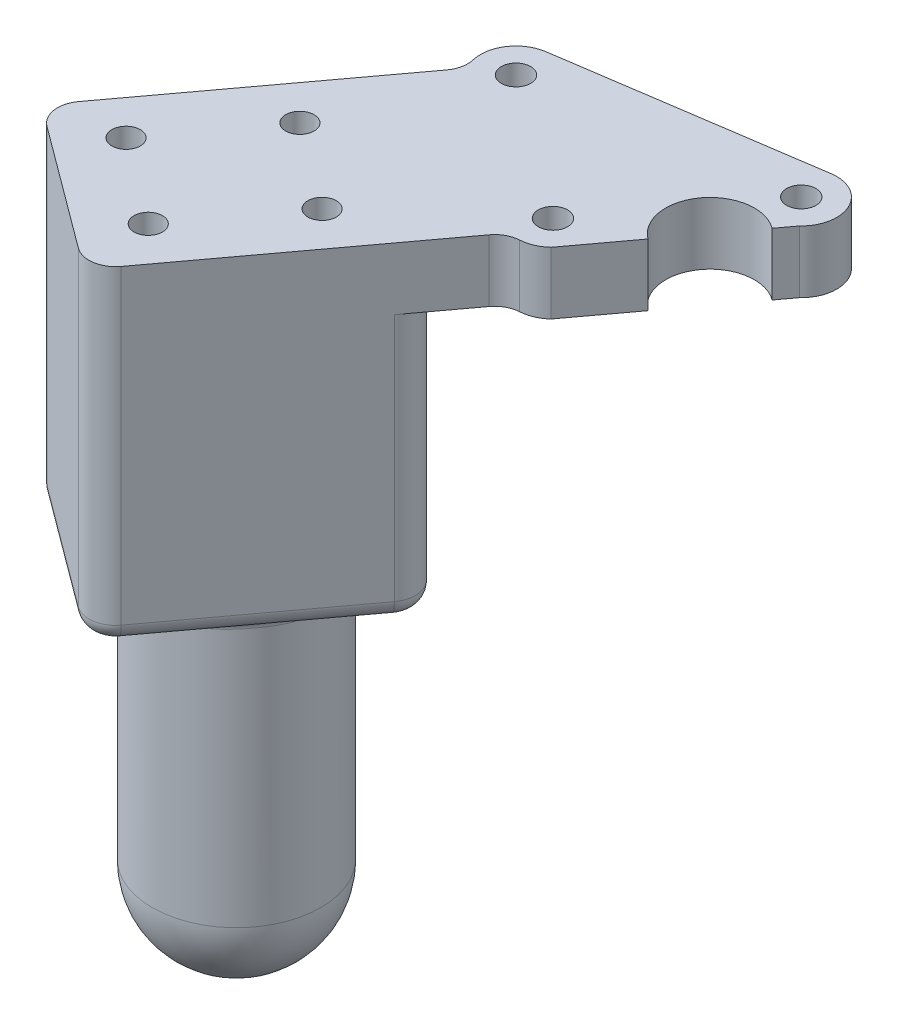
from build123d import *

# Parameters (mm, degrees)
SKETCH1_R           = 1.650000007
BOSS_EXTRUDE1_DEPTH = 3.5
SKETCH8_R           = 5
CUT_EXTRUDE3_DEPTH  = 10
SKETCH9_R           = 1.6
CUT_EXTRUDE4_DEPTH  = 10
BOSS_EXTRUDE5_DEPTH = 30
FILLET4_R           = 2
SKETCH13_R          = 9.5
BOSS_EXTRUDE6_DEPTH = 30
FILLET5_R           = 1
REVOLVE2_ANGLE      = 180


with BuildPart() as part:
    # Sketch1 → Boss-Extrude1 (new, symmetric)
    with BuildSketch(Plane(origin=(0, 0, 0), x_dir=(1, 0, 0), z_dir=(0, 1, 0))):
        with BuildLine():
            Line((-3.163944782, -93.076388076), (-20.805834618, -116.891940565))
            ThreePointArc((-20.805834618, -116.891940565), (-21.362478255, -119.119545961), (-20.180929864, -121.088307332))
            Line((-20.180929864, -121.088307332), (-6.520660553, -131.207449705))
            ThreePointArc((-6.520660553, -131.207449705), (-4.293055157, -131.764093342), (-2.324293786, -130.582544951))
            Line((-2.324293786, -130.582544951), (15.317595998, -106.766992534))
            ThreePointArc((15.317595998, -106.766992534), (16.298016652, -105.915587831), (17.546382486, -105.558240139))
            ThreePointArc((17.546382486, -105.558240139), (18.880171652, -105.241928098), (20.028844772, -104.493865997))
            Line((20.028844772, -104.493865997), (31.933718152, -88.422960925))
            ThreePointArc((31.933718152, -88.422960925), (32.812947077, -83.759740105), (28.619624318, -81.538318002))
            Line((28.619624318, -81.538318002), (0.643845867, -85.704349694))
            ThreePointArc((0.643845867, -85.704349694), (-2.081865152, -87.422063847), (-2.657041002, -90.592113564))
            ThreePointArc((-2.657041002, -90.592113564), (-2.635147269, -91.890433717), (-3.163944782, -93.076388076))
        make_face()
        with Locations(Location((1.233011719, -89.660722224, 0), (0, 0, 90))):
            Circle(SKETCH1_R, mode=Mode.SUBTRACT)
        with Locations(Location((29.20879017, -85.494690532, 0), (0, 0, 90))):
            Circle(SKETCH1_R, mode=Mode.SUBTRACT)
        with Locations(Location((17.30391679, -101.565595604, 0), (0, 0, 90))):
            Circle(SKETCH1_R, mode=Mode.SUBTRACT)
    extrude(amount=BOSS_EXTRUDE1_DEPTH, both=True)

    # Sketch8 → Cut-Extrude3 (cut)
    with BuildSketch(Plane(origin=(0, 3.5, 0), x_dir=(1, 0, 0), z_dir=(0, 1, 0))):
        with Locations((27.647963735, -94.208486751)):
            Circle(SKETCH8_R)
    extrude(amount=-CUT_EXTRUDE3_DEPTH, mode=Mode.SUBTRACT)

    # Sketch9 → Cut-Extrude4 (cut)
    with BuildSketch(Plane(origin=(0, 3.5, 0), x_dir=(1, 0, 0), z_dir=(0, 1, 0))):
        with Locations(Location((-6.267193351, -106.505511433, 0), (0, 0, 270))):
            Circle(SKETCH9_R)
        with Locations(Location((3.375349692, -113.648435461, 0), (0, 0, 270))):
            Circle(SKETCH9_R)
        with Locations(Location((-4.958061673, -124.898069011, 0), (0, 0, 270))):
            Circle(SKETCH9_R)
        with Locations(Location((-14.600604716, -117.755144983, 0), (0, 0, 270))):
            Circle(SKETCH9_R)
    extrude(amount=-CUT_EXTRUDE4_DEPTH, mode=Mode.SUBTRACT)

    # Sketch11 → Boss-Extrude5 (add)
    with BuildSketch(Plane.XZ.offset(3.5)):
        with BuildLine():
            Line((-3.514107133, 98.589040232), (10.146162178, 108.708182605))
            ThreePointArc((10.146162178, 108.708182605), (11.327710569, 110.676943976), (10.771066932, 112.904549372))
            Line((10.771066932, 112.904549372), (-2.324293786, 130.582544951))
            ThreePointArc((-2.324293786, 130.582544951), (-4.293055157, 131.764093342), (-6.520660553, 131.207449705))
            Line((-6.520660553, 131.207449705), (-20.180929864, 121.088307332))
            ThreePointArc((-20.180929864, 121.088307332), (-21.362478255, 119.119545961), (-20.805834618, 116.891940565))
            Line((-20.805834618, 116.891940565), (-7.710473901, 99.213944986))
            ThreePointArc((-7.710473901, 99.213944986), (-5.741712529, 98.032396595), (-3.514107133, 98.589040232))
        make_face()
    extrude(amount=BOSS_EXTRUDE5_DEPTH)

    # Fillet4
    fillet4_edges = [part.edges().sort_by_distance(p)[0] for p in [
        (-21.362478255, -33.5, 119.119545961),
        (-14.258154259, -33.5, 108.052942775),
        (-5.741712529, -33.5, 98.032396595),
        (3.316027522, -33.5, 103.648611418),
        (11.327710569, -33.5, 110.676943976),
        (4.223386573, -33.5, 121.743547162),
        (-4.293055157, -33.5, 131.764093342),
        (-13.350795209, -33.5, 126.147878519),
    ]]
    fillet(fillet4_edges, radius=FILLET4_R)

    # Sketch13 → Boss-Extrude6 (add)
    with BuildSketch(Plane.XZ.offset(33.5)):
        with Locations(Location((-5.017383843, 114.898244969, 0), (0, 0, 36.530004657))):
            Circle(SKETCH13_R)
    extrude(amount=BOSS_EXTRUDE6_DEPTH)

    # Fillet5
    fillet5_edges = [part.edges().sort_by_distance(p)[0] for p in [
        (-10.672198638, -33.5, 122.531924922),
        (0.637430952, -33.5, 107.264565015),
    ]]
    fillet(fillet5_edges, radius=FILLET5_R)

    # Sketch14 → Revolve2 (revolve)
    with BuildSketch(Plane.XZ.offset(63.5)):
        with BuildLine():
            Line((-5.017383843, 124.398244969), (-5.017383843, 105.398244968))
            ThreePointArc((-5.017383843, 105.398244968), (4.482616157, 114.898244969), (-5.017383843, 124.398244969))
        make_face()
    revolve(axis=Axis((-5.017383843, -63.5, 124.398244969), (0, 0, -1)), revolution_arc=REVOLVE2_ANGLE)


solid = part.part
